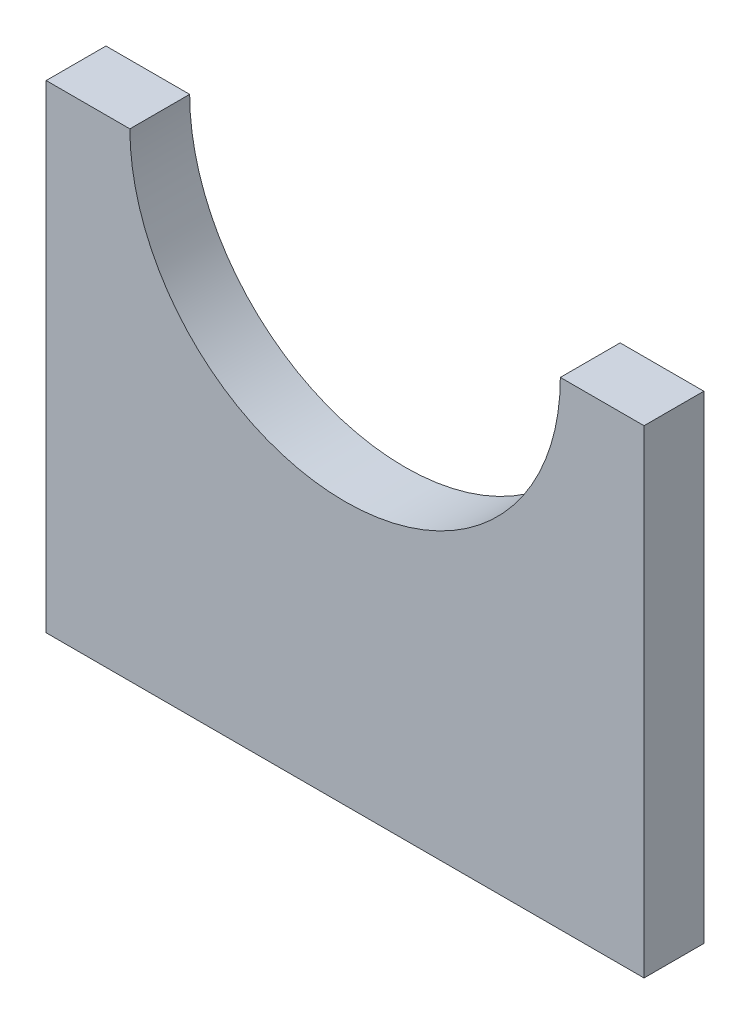
from build123d import *

# Parameters (mm, degrees)
BOSS_EXTRUDE1_DEPTH = 2.5


with BuildPart() as part:
    # Sketch1 → Boss-Extrude1 (new, symmetric)
    with BuildSketch(Plane.XY):
        with BuildLine():
            Line((-25, 0), (-25, -40))
            Line((-25, -40), (25, -40))
            Line((25, -40), (25, 0))
            Line((25, 0), (18, 0))
            ThreePointArc((18, 0), (0, -18), (-18, 0))
            Line((-18, 0), (-25, 0))
        make_face()
    extrude(amount=BOSS_EXTRUDE1_DEPTH, both=True)


solid = part.part
